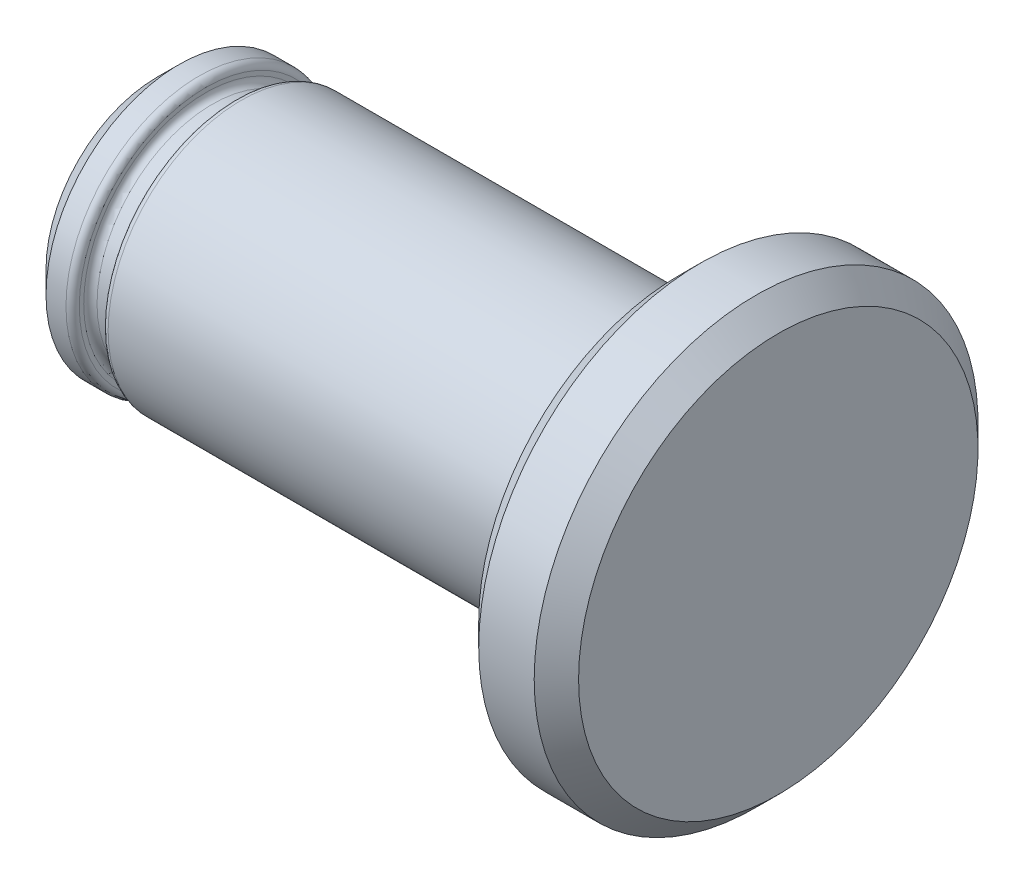
from build123d import *


with BuildPart() as part:
    # Sketch1 → Revolve1 (revolve)
    with BuildSketch(Plane(origin=(0, 0, 0), x_dir=(-1, 0, 0), z_dir=(0, 1, 0))):
        with BuildLine():
            Line((-1, 10), (-3.5, 10))
            Line((-3.5, 10), (-4.5, 9))
            Line((-4.5, 9), (-4.5, 0))
            Line((-4.5, 0), (23.5, 0))
            Line((23.5, 0), (23.5, 5))
            Line((23.5, 5), (22.5, 6))
            Line((22.5, 6), (21.6, 6))
            ThreePointArc((21.6, 6), (21.387867966, 5.912132034), (21.3, 5.7))
            Line((21.3, 5.7), (21.3, 5.5))
            ThreePointArc((21.3, 5.5), (21.212132034, 5.287867966), (21, 5.2))
            Line((21, 5.2), (20.3, 5.2))
            ThreePointArc((20.3, 5.2), (20.087867966, 5.287867966), (20, 5.5))
            Line((20, 5.5), (20, 5.7))
            ThreePointArc((20, 5.7), (19.912132034, 5.912132034), (19.7, 6))
            Line((19.7, 6), (2, 6))
            ThreePointArc((2, 6), (0.585786438, 6.585786438), (0, 8))
            Line((0, 8), (0, 9))
            Line((0, 9), (-1, 10))
        make_face()
    revolve(axis=Axis((-23.5, 0, 0), (1, 0, 0)))


solid = part.part
